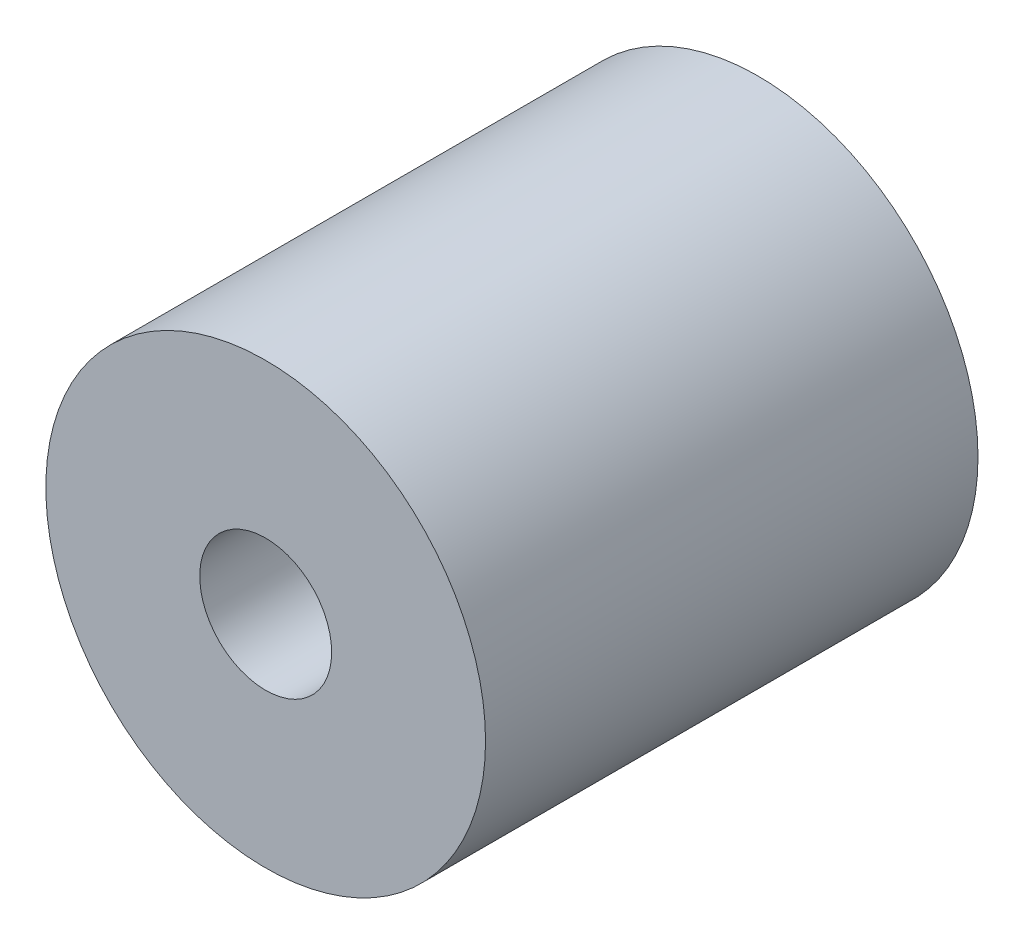
from build123d import *

# Parameters (mm, degrees)
SKETCH1_R           = 7.9375
SKETCH1_R_2         = 2.38125
BOSS_EXTRUDE1_DEPTH = 17.78


with BuildPart() as part:
    # Sketch1 → Boss-Extrude1 (new body)
    with BuildSketch(Plane.XY):
        Circle(SKETCH1_R)
        Circle(SKETCH1_R_2, mode=Mode.SUBTRACT)
    extrude(amount=BOSS_EXTRUDE1_DEPTH)


solid = part.part
